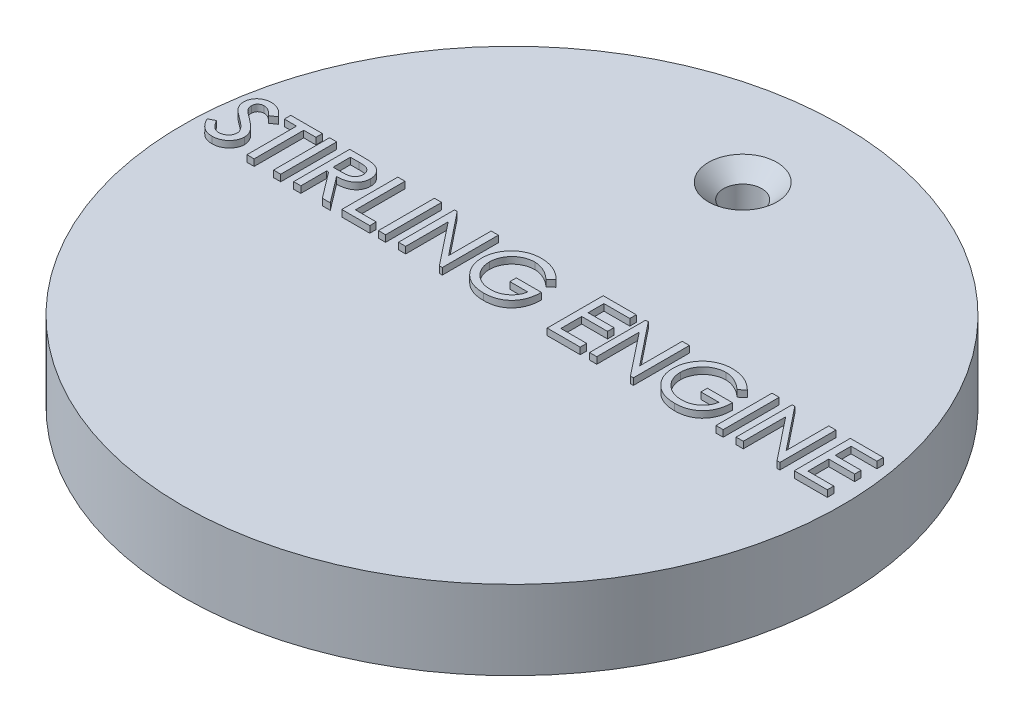
from build123d import *

# Parameters (mm, degrees)
SKETCH1_R                                       = 50
BOSS_EXTRUDE1_DEPTH                             = 12
SKETCH2_W                                       = 1.089743589
SKETCH2_H                                       = 8.5
SKETCH2_W_2                                     = 1.08974359
BOSS_EXTRUDE2_DEPTH                             = 1
CSK_FOR_M5_FLAT_HEAD_MACHINE_SCREW1_D           = 5.8
CSK_FOR_M5_FLAT_HEAD_MACHINE_SCREW1_CSINK_D     = 10.4
CSK_FOR_M5_FLAT_HEAD_MACHINE_SCREW1_CSINK_ANGLE = 90


with BuildPart() as part:
    # Sketch1 → Boss-Extrude1 (new body)
    with BuildSketch(Plane(origin=(0, 0, 0), x_dir=(1, 0, 0), z_dir=(0, 1, 0))):
        with Locations(Location((0, 0, 0), (0, 0, 270))):
            Circle(SKETCH1_R)
    extrude(amount=BOSS_EXTRUDE1_DEPTH)

    # Sketch2 → Boss-Extrude2 (add)
    # profile 1 of 14: a face of its own
    with BuildSketch(Plane(origin=(0, 12, 0), x_dir=(1, 0, 0), z_dir=(0, 1, 0))):
        with BuildLine():
            Line((-47.948717949, 1.685697115), (-47.022435897, 2.179487179))
            add(Edge.make_bspline(
                [(-47.022435897, 2.179487179), (-46.954932513, 2.06767303), (-46.825914844, 1.853965214), (-46.614061284, 1.566075414), (-46.403421464, 1.320581075), (-46.191916121, 1.117730072), (-45.976607283, 0.960780792), (-45.759693014, 0.847350269), (-45.539815692, 0.776055414), (-45.391149535, 0.767184716), (-45.318008814, 0.762820513)],
                knots=[0, 0, 0, 0, 1.354943589, 2.589672558, 3.704607527, 4.708856974, 5.624398268, 6.459549776, 7.242129862, 8, 8, 8, 8], degree=3))
            add(Edge.make_bspline(
                [(-45.318008814, 0.762820513), (-45.249728015, 0.765015342), (-45.114483395, 0.769362668), (-44.915767788, 0.80706469), (-44.723358464, 0.864509279), (-44.540589522, 0.9463091), (-44.371736126, 1.046523914), (-44.222675693, 1.165725135), (-44.096202073, 1.300678484), (-43.991958489, 1.449553226), (-43.910246149, 1.608506118), (-43.850093324, 1.773026745), (-43.814789618, 1.943589153), (-43.810075325, 2.058433808), (-43.807692308, 2.116486378)],
                knots=[0, 0, 0, 0, 1.0888553, 2.156709112, 3.216967111, 4.287545289, 5.343926646, 6.34269433, 7.323221176, 8.28571565, 9.233736345, 10.167849744, 11.073870434, 12, 12, 12, 12], degree=3))
            add(Edge.make_bspline(
                [(-43.807692308, 2.116486378), (-43.811031138, 2.182647984), (-43.817778151, 2.316345457), (-43.871931311, 2.514954649), (-43.959940078, 2.711620544), (-44.041350172, 2.834411471), (-44.083533654, 2.898036859)],
                knots=[0, 0, 0, 0, 0.941861274, 1.903286225, 2.913566088, 4, 4, 4, 4], degree=3))
            add(Edge.make_bspline(
                [(-44.083533654, 2.898036859), (-44.120009872, 2.944351522), (-44.196795407, 3.041847821), (-44.32677154, 3.188630016), (-44.478860675, 3.341745621), (-44.652816098, 3.500503879), (-44.845580199, 3.668462087), (-45.060427389, 3.841279278), (-45.295838852, 4.021876093), (-45.46080867, 4.143034561), (-45.546173878, 4.205729167)],
                knots=[0, 0, 0, 0, 0.718593868, 1.512701116, 2.388487339, 3.348232282, 4.383172848, 5.504845107, 6.708858268, 8, 8, 8, 8], degree=3))
            add(Edge.make_bspline(
                [(-45.546173878, 4.205729167), (-45.633224047, 4.269011825), (-45.800248943, 4.390433525), (-46.035572439, 4.5684383), (-46.246562855, 4.732568567), (-46.431602237, 4.882952609), (-46.590711614, 5.020897498), (-46.723555811, 5.145837186), (-46.834133988, 5.254342998), (-46.893555548, 5.327350801), (-46.920272436, 5.360176282)],
                knots=[0, 0, 0, 0, 1.435833971, 2.754963323, 3.936484598, 5.002077172, 5.935979083, 6.744956812, 7.435712417, 8, 8, 8, 8], degree=3))
            add(Edge.make_bspline(
                [(-46.920272436, 5.360176282), (-46.959275482, 5.410572014), (-47.035900104, 5.509578482), (-47.132909527, 5.66839127), (-47.216383964, 5.829282547), (-47.285137541, 5.993742065), (-47.338417421, 6.161244435), (-47.37507146, 6.332377073), (-47.400926583, 6.506460207), (-47.402869458, 6.624069949), (-47.403846154, 6.683193109)],
                knots=[0, 0, 0, 0, 1.064105702, 2.090521257, 3.104283852, 4.09061442, 5.065433238, 6.036507983, 7.012940167, 8, 8, 8, 8], degree=3))
            add(Edge.make_bspline(
                [(-47.403846154, 6.683193109), (-47.400770421, 6.775394691), (-47.394680694, 6.957947077), (-47.340260599, 7.224446215), (-47.252071898, 7.478372297), (-47.131695259, 7.718412924), (-46.977976485, 7.94009996), (-46.795134249, 8.139055339), (-46.58217925, 8.311033731), (-46.344793489, 8.45594373), (-46.088919627, 8.573466703), (-45.819424486, 8.657231695), (-45.539575093, 8.708013), (-45.349435678, 8.71461227), (-45.253305288, 8.717948718)],
                knots=[0, 0, 0, 0, 1.004530234, 1.988896367, 2.951881425, 3.928924249, 4.907494835, 5.884204368, 6.865296418, 7.88218147, 8.909671266, 9.927572845, 10.952225504, 12, 12, 12, 12], degree=3))
            add(Edge.make_bspline(
                [(-45.253305288, 8.717948718), (-45.144154717, 8.714041827), (-44.927981482, 8.70630421), (-44.609321811, 8.653867628), (-44.304604877, 8.559459163), (-44.059189016, 8.45524975), (-43.868545784, 8.348703831), (-43.724358407, 8.252474624), (-43.576573783, 8.14357056), (-43.429872688, 8.016562852), (-43.278537509, 7.877596609), (-43.130317825, 7.719117947), (-42.975833595, 7.550209476), (-42.877371, 7.428396971), (-42.826923077, 7.365985577)],
                knots=[0, 0, 0, 0, 1.360590218, 2.69465552, 4.010645498, 5.328858611, 6.009843139, 6.729980544, 7.488405022, 8.296451933, 9.147430815, 10.048128915, 10.999946711, 12, 12, 12, 12], degree=3))
            Line((-42.826923077, 7.365985577), (-43.715745192, 6.756410256))
            add(Edge.make_bspline(
                [(-43.715745192, 6.756410256), (-43.762130411, 6.805937116), (-43.851317546, 6.901164838), (-43.982509969, 7.036212299), (-44.106635889, 7.157407742), (-44.22407201, 7.264196739), (-44.332186168, 7.358483735), (-44.434016272, 7.437089352), (-44.526377965, 7.504647311), (-44.641838274, 7.571604702), (-44.783383902, 7.637918304), (-44.957593356, 7.697585336), (-45.140331571, 7.729473696), (-45.263979695, 7.734591061), (-45.326522436, 7.737179487)],
                knots=[0, 0, 0, 0, 1.253377364, 2.409930098, 3.477532466, 4.457083962, 5.341772995, 6.126101147, 6.832963523, 7.453284126, 8.588253012, 9.715448048, 10.844445545, 12, 12, 12, 12], degree=3))
            add(Edge.make_bspline(
                [(-45.326522436, 7.737179487), (-45.393280135, 7.734059761), (-45.523062552, 7.727994758), (-45.709488187, 7.676058214), (-45.880858414, 7.59410412), (-46.032055, 7.47811713), (-46.157724873, 7.334556293), (-46.249888645, 7.166392957), (-46.303825425, 6.974748481), (-46.310580172, 6.840196665), (-46.314102564, 6.770032051)],
                knots=[0, 0, 0, 0, 1.033513523, 2.009234674, 2.977584268, 3.963375862, 4.942860848, 5.915719707, 6.913112236, 8, 8, 8, 8], degree=3))
            add(Edge.make_bspline(
                [(-46.314102564, 6.770032051), (-46.31273013, 6.724567641), (-46.309988582, 6.633748788), (-46.289851138, 6.499220245), (-46.25262708, 6.369233757), (-46.205456677, 6.241049521), (-46.139434275, 6.115387777), (-46.055350805, 5.992050095), (-45.955535965, 5.867483122), (-45.878931746, 5.789174321), (-45.839042468, 5.748397436)],
                knots=[0, 0, 0, 0, 0.940834015, 1.879392378, 2.805520916, 3.734846727, 4.701501436, 5.734192883, 6.820151034, 8, 8, 8, 8], degree=3))
            add(Edge.make_bspline(
                [(-45.839042468, 5.748397436), (-45.818844828, 5.729396492), (-45.772487009, 5.68578534), (-45.687461789, 5.619003731), (-45.583871813, 5.535277434), (-45.460280955, 5.435973005), (-45.312625268, 5.326481835), (-45.146364104, 5.199489011), (-44.957287717, 5.060711605), (-44.824234135, 4.963419227), (-44.754407051, 4.912359776)],
                knots=[0, 0, 0, 0, 0.485581606, 1.114511607, 1.892484918, 2.819534315, 3.891398566, 5.11240712, 6.484579029, 8, 8, 8, 8], degree=3))
            add(Edge.make_bspline(
                [(-44.754407051, 4.912359776), (-44.659275524, 4.84301863), (-44.47524027, 4.708875768), (-44.213811875, 4.506538914), (-43.978040386, 4.308199029), (-43.761964933, 4.120775727), (-43.572892822, 3.936406973), (-43.40728148, 3.758883606), (-43.26305114, 3.589938391), (-43.109011408, 3.374537969), (-42.955002555, 3.108986255), (-42.817286809, 2.788017113), (-42.735107506, 2.464515904), (-42.723619054, 2.248597648), (-42.717948718, 2.142027244)],
                knots=[0, 0, 0, 0, 1.186540699, 2.295404303, 3.331123753, 4.291760032, 5.17774712, 5.991329992, 6.738459906, 7.414799035, 8.65800623, 9.82461674, 10.926299804, 12, 12, 12, 12], degree=3))
            add(Edge.make_bspline(
                [(-42.717948718, 2.142027244), (-42.720361425, 2.066417095), (-42.725156865, 1.916136145), (-42.759925126, 1.693936138), (-42.817776455, 1.477965355), (-42.901006072, 1.269135764), (-43.004817904, 1.065487448), (-43.133537631, 0.868800827), (-43.286745696, 0.679833812), (-43.457978503, 0.497444544), (-43.647318754, 0.329821696), (-43.850364678, 0.182291482), (-44.06649636, 0.059045563), (-44.294048312, -0.040947107), (-44.531685365, -0.122428714), (-44.781755922, -0.1782368), (-45.043023166, -0.210450051), (-45.22086437, -0.215422823), (-45.311197917, -0.217948718)],
                knots=[0, 0, 0, 0, 0.932646097, 1.853705421, 2.767602683, 3.685675702, 4.622099834, 5.5835355, 6.579838097, 7.620108014, 8.666886363, 9.695041649, 10.711275682, 11.730160242, 12.757671447, 13.80585424, 14.885494678, 16, 16, 16, 16], degree=3))
            add(Edge.make_bspline(
                [(-45.311197917, -0.217948718), (-45.377070165, -0.216485611), (-45.506811257, -0.213603896), (-45.699421976, -0.195324662), (-45.8868562, -0.160192158), (-46.070141565, -0.114769368), (-46.249392463, -0.056929578), (-46.422298847, 0.017058116), (-46.591740008, 0.102043209), (-46.75674395, 0.201551949), (-46.917521087, 0.318068848), (-47.074985091, 0.453322052), (-47.228221294, 0.609689142), (-47.379856489, 0.785138583), (-47.527887376, 0.981643816), (-47.671968359, 1.198171555), (-47.813939096, 1.434023558), (-47.902906157, 1.600152415), (-47.948717949, 1.685697115)],
                knots=[0, 0, 0, 0, 0.916943493, 1.805999526, 2.689245248, 3.568702553, 4.433092864, 5.307568578, 6.183755457, 7.069823058, 7.986358083, 8.944343836, 9.955449961, 11.030835633, 12.170024038, 13.377301724, 14.649494474, 16, 16, 16, 16], degree=3))
        make_face()
    # profile 2 of 14: a face of its own
    with BuildSketch(Plane(origin=(0, 12, 0), x_dir=(1, 0, 0), z_dir=(0, 1, 0))):
        Polygon((-42.064102564, 7.519230769), (-42.064102564, 8.5), (-37.269230769, 8.5), (-37.269230769, 7.519230769), (-39.121794872, 7.519230769), (-39.121794872, 0), (-40.211538462, 0), (-40.211538462, 7.519230769), align=None)
    # profile 3 of 14: a face of its own
    with BuildSketch(Plane(origin=(0, 12, 0), x_dir=(1, 0, 0), z_dir=(0, 1, 0))):
        with Locations((-35.634615385, 4.25)):
            Rectangle(SKETCH2_W, SKETCH2_H)
    # profile 4 of 14: a face of its own
    with BuildSketch(Plane(origin=(0, 12, 0), x_dir=(1, 0, 0), z_dir=(0, 1, 0))):
        with BuildLine():
            Line((-33.128205128, 8.5), (-31.388020833, 8.5))
            add(Edge.make_bspline(
                [(-31.388020833, 8.5), (-31.276205034, 8.499729639), (-31.062209641, 8.499212216), (-30.75514321, 8.493782567), (-30.476335061, 8.486591479), (-30.225574474, 8.471570338), (-30.002189945, 8.458311396), (-29.807147645, 8.43650415), (-29.639529301, 8.417054448), (-29.538751966, 8.395655871), (-29.492888622, 8.385917468)],
                knots=[0, 0, 0, 0, 1.411347063, 2.701065231, 3.876524531, 4.931206492, 5.871916627, 6.700262025, 7.408494688, 8, 8, 8, 8], degree=3))
            add(Edge.make_bspline(
                [(-29.492888622, 8.385917468), (-29.424502882, 8.368726156), (-29.289772558, 8.334856654), (-29.095666773, 8.268174783), (-28.912413537, 8.189561641), (-28.740254379, 8.099449604), (-28.578775361, 7.997386051), (-28.43110056, 7.880291963), (-28.291412472, 7.754148615), (-28.165100943, 7.614998398), (-28.050176556, 7.467028572), (-27.951913196, 7.310265215), (-27.867602367, 7.146813664), (-27.797235489, 6.976916893), (-27.744621013, 6.798680305), (-27.70776762, 6.613415694), (-27.682404797, 6.421673288), (-27.680465916, 6.291082045), (-27.679487179, 6.225160256)],
                knots=[0, 0, 0, 0, 1.103820101, 2.174693741, 3.209859002, 4.223626675, 5.214778413, 6.196198804, 7.171320727, 8.158999421, 9.134971582, 10.10159085, 11.051641808, 12.012235658, 12.97676874, 13.956376421, 14.968389326, 16, 16, 16, 16], degree=3))
            add(Edge.make_bspline(
                [(-27.679487179, 6.225160256), (-27.683130658, 6.116440532), (-27.690291323, 5.902769545), (-27.755367576, 5.591146401), (-27.862009256, 5.297395947), (-27.983645147, 5.067925131), (-28.101974997, 4.897327606), (-28.201043034, 4.776045853), (-28.309957581, 4.66242357), (-28.427946368, 4.555277838), (-28.558114449, 4.459343504), (-28.696490859, 4.368382741), (-28.844707937, 4.284764146), (-29.058354913, 4.184359285), (-29.347324968, 4.079709104), (-29.720696362, 3.989992334), (-30.124152428, 3.935495617), (-30.403105761, 3.927300559), (-30.546875, 3.923076923)],
                knots=[0, 0, 0, 0, 1.258986715, 2.474334223, 3.670931197, 4.871716255, 5.472099774, 6.075216246, 6.684756624, 7.295006596, 7.919971941, 8.55677058, 9.213641309, 9.890468445, 11.291088691, 12.766994829, 14.333747493, 16, 16, 16, 16], degree=3))
            Line((-30.546875, 3.923076923), (-27.570512821, 0))
            Line((-27.570512821, 0), (-28.770933494, 0))
            Line((-28.770933494, 0), (-31.747295673, 3.923076923))
            Line((-31.747295673, 3.923076923), (-32.038461538, 3.923076923))
            Line((-32.038461538, 3.923076923), (-32.038461538, 0))
            Line((-32.038461538, 0), (-33.128205128, 0))
            Line((-33.128205128, 0), (-33.128205128, 8.5))
        make_face()
        with BuildLine():
            Line((-32.038461538, 7.519230769), (-32.038461538, 4.902143429))
            Line((-32.038461538, 4.902143429), (-30.788661859, 4.893629808))
            add(Edge.make_bspline(
                [(-30.788661859, 4.893629808), (-30.721681759, 4.89380287), (-30.592223558, 4.894137364), (-30.404835056, 4.90102502), (-30.231027696, 4.912558601), (-30.071488031, 4.929640519), (-29.926678807, 4.950019823), (-29.795490014, 4.972844814), (-29.679153489, 5.003665839), (-29.543257818, 5.048093228), (-29.392276017, 5.119470028), (-29.232112307, 5.228144173), (-29.091723162, 5.356757357), (-28.976596792, 5.507458549), (-28.884483386, 5.672794351), (-28.81747299, 5.849323229), (-28.77710643, 6.036050149), (-28.771885871, 6.163663423), (-28.769230769, 6.228565705)],
                knots=[0, 0, 0, 0, 1.165824803, 2.253289887, 3.263370799, 4.197285623, 5.045371766, 5.808848116, 6.513348392, 7.138183875, 8.296069948, 9.40583476, 10.496436725, 11.595152671, 12.691956992, 13.780050175, 14.870965332, 16, 16, 16, 16], degree=3))
            add(Edge.make_bspline(
                [(-28.769230769, 6.228565705), (-28.772011479, 6.291173178), (-28.777526912, 6.415352745), (-28.816755041, 6.597602095), (-28.886874129, 6.769536653), (-28.9799062, 6.930935406), (-29.095177433, 7.076031346), (-29.227741985, 7.203885902), (-29.380881536, 7.305228432), (-29.521869673, 7.373627828), (-29.648225995, 7.416525363), (-29.760109229, 7.443017075), (-29.887457915, 7.466408577), (-30.030532255, 7.486967735), (-30.189067827, 7.501988471), (-30.36346009, 7.511438468), (-30.553622984, 7.518863472), (-30.68592243, 7.519105248), (-30.754607372, 7.519230769)],
                knots=[0, 0, 0, 0, 1.114111647, 2.20979856, 3.297775031, 4.406653707, 5.514151176, 6.585969385, 7.670234779, 8.768154562, 9.365517569, 10.041721951, 10.812428959, 11.669578816, 12.61341719, 13.645562296, 14.777663698, 16, 16, 16, 16], degree=3))
            Line((-30.754607372, 7.519230769), (-32.038461538, 7.519230769))
        make_face(mode=Mode.SUBTRACT)
    # profile 5 of 14: a face of its own
    with BuildSketch(Plane(origin=(0, 12, 0), x_dir=(1, 0, 0), z_dir=(0, 1, 0))):
        Polygon((-25.826923077, 8.5), (-24.737179487, 8.5), (-24.737179487, 0.980769231), (-21.576923077, 0.980769231), (-21.576923077, 0), (-25.826923077, 0), align=None)
    # profile 6 of 14: a face of its own
    with BuildSketch(Plane(origin=(0, 12, 0), x_dir=(1, 0, 0), z_dir=(0, 1, 0))):
        with Locations((-19.724358974, 4.25)):
            Rectangle(SKETCH2_W_2, SKETCH2_H)
    # profile 7 of 14: a face of its own
    with BuildSketch(Plane(origin=(0, 12, 0), x_dir=(1, 0, 0), z_dir=(0, 1, 0))):
        Polygon((-17.217948718, 0), (-17.217948718, 8.5), (-16.814403045, 8.5), (-11.66025641, 2.041566506), (-11.66025641, 8.5), (-10.570512821, 8.5), (-10.570512821, 0), (-11.016626603, 0), (-16.128205128, 6.44140625), (-16.128205128, 0), align=None)
    # profile 8 of 14: a face of its own
    with BuildSketch(Plane(origin=(0, 12, 0), x_dir=(1, 0, 0), z_dir=(0, 1, 0))):
        with BuildLine():
            Line((-0.326923077, 7.0390625), (-1.152744391, 6.320512821))
            add(Edge.make_bspline(
                [(-1.152744391, 6.320512821), (-1.282304451, 6.433644896), (-1.534524014, 6.653883469), (-1.929446562, 6.94480759), (-2.32657891, 7.19019412), (-2.726026212, 7.387113639), (-3.121045934, 7.544833274), (-3.513438094, 7.653264975), (-3.900082674, 7.724105045), (-4.15719249, 7.732859769), (-4.284054487, 7.737179487)],
                knots=[0, 0, 0, 0, 1.174203348, 2.285866929, 3.345479548, 4.357773815, 5.323690501, 6.245291137, 7.134199255, 8, 8, 8, 8], degree=3))
            add(Edge.make_bspline(
                [(-4.284054487, 7.737179487), (-4.357332831, 7.736031602), (-4.503660399, 7.733739422), (-4.721976988, 7.710169092), (-4.938164954, 7.675009572), (-5.15235591, 7.624690311), (-5.36500299, 7.562647183), (-5.574478468, 7.483528119), (-5.782071291, 7.390979749), (-5.986098961, 7.284474), (-6.184405599, 7.166324326), (-6.372881938, 7.036294491), (-6.550352928, 6.894595631), (-6.717151144, 6.741628657), (-6.872297005, 6.577160089), (-7.018089687, 6.403555997), (-7.150753192, 6.216746756), (-7.272869951, 6.020755295), (-7.380559959, 5.816973547), (-7.477488672, 5.610305274), (-7.557283428, 5.398997794), (-7.621860942, 5.18375461), (-7.673295209, 4.964857232), (-7.710632545, 4.7425468), (-7.733737738, 4.516117735), (-7.736025342, 4.364137293), (-7.737179487, 4.287459936)],
                knots=[0, 0, 0, 0, 0.9732313, 1.943419598, 2.914105962, 3.881741322, 4.864768402, 5.855028487, 6.854206409, 7.882911434, 8.911035887, 9.919250175, 10.922630637, 11.925982763, 12.923451909, 13.924676513, 14.935397504, 15.964931351, 16.990480746, 17.995899336, 18.995873688, 19.988284801, 20.979664002, 21.981342857, 22.981544644, 24, 24, 24, 24], degree=3))
            add(Edge.make_bspline(
                [(-7.737179487, 4.287459936), (-7.735227479, 4.209094488), (-7.731330178, 4.052633233), (-7.709692988, 3.819732372), (-7.670080352, 3.591113379), (-7.61505589, 3.366518566), (-7.54553741, 3.145671956), (-7.460277402, 2.928004786), (-7.356988991, 2.715698291), (-7.242444063, 2.50680181), (-7.113545235, 2.306314648), (-6.9712111, 2.117338869), (-6.820246997, 1.93743349), (-6.656121401, 1.771606851), (-6.483781442, 1.614310505), (-6.297218777, 1.472459668), (-6.101675531, 1.33908197), (-5.89584922, 1.218255476), (-5.681561531, 1.11169648), (-5.462364801, 1.017676922), (-5.237542919, 0.939072806), (-5.008484348, 0.874283293), (-4.773987512, 0.825016345), (-4.535753957, 0.789661999), (-4.292472452, 0.766122998), (-4.128594512, 0.763930106), (-4.045673077, 0.762820513)],
                knots=[0, 0, 0, 0, 0.993588149, 1.983757546, 2.962012758, 3.932297264, 4.913089422, 5.895147596, 6.892791648, 7.904042674, 8.913936126, 9.911190904, 10.901569418, 11.888649192, 12.866825019, 13.856968273, 14.856789458, 15.866221433, 16.879824684, 17.888846278, 18.887838639, 19.896937192, 20.90452114, 21.923117541, 22.949107649, 24, 24, 24, 24], degree=3))
            add(Edge.make_bspline(
                [(-4.045673077, 0.762820513), (-3.94227144, 0.765147493), (-3.73830782, 0.769737549), (-3.438920137, 0.804885228), (-3.151024205, 0.859154061), (-2.877553434, 0.943500287), (-2.614147221, 1.043822887), (-2.364735003, 1.171623324), (-2.126330362, 1.319803022), (-1.904056191, 1.491726314), (-1.696909417, 1.676898725), (-1.51243757, 1.876247927), (-1.347464798, 2.083306094), (-1.208374353, 2.303045846), (-1.087640834, 2.52930835), (-0.99200385, 2.766863967), (-0.917870444, 3.013694014), (-0.887211481, 3.183729706), (-0.871794872, 3.269230769)],
                knots=[0, 0, 0, 0, 1.125101743, 2.219305524, 3.276925285, 4.308813505, 5.329771737, 6.340890082, 7.353855978, 8.380572537, 9.395307413, 10.374367262, 11.333343716, 12.272376171, 13.200803521, 14.12078735, 15.055053215, 16, 16, 16, 16], degree=3))
            Line((-0.871794872, 3.269230769), (-3.596153846, 3.269230769))
            Line((-3.596153846, 3.269230769), (-3.596153846, 4.25))
            Line((-3.596153846, 4.25), (0.217948718, 4.25))
            add(Edge.make_bspline(
                [(0.217948718, 4.25), (0.214086088, 4.081802362), (0.2065458, 3.753461688), (0.146011486, 3.274850472), (0.056756583, 2.822254966), (-0.073643336, 2.397584395), (-0.238868446, 2.000240248), (-0.440665249, 1.630213092), (-0.678637294, 1.287610743), (-0.951179342, 0.974365113), (-1.254180196, 0.69338788), (-1.584426357, 0.447325135), (-1.943398384, 0.243100387), (-2.326511443, 0.073438551), (-2.73588664, -0.057651617), (-3.17046992, -0.150501712), (-3.630940159, -0.207941251), (-3.946742757, -0.214556618), (-4.108673878, -0.217948718)],
                knots=[0, 0, 0, 0, 1.147910205, 2.240849596, 3.288798376, 4.293882934, 5.268269983, 6.221997348, 7.165762291, 8.110600512, 9.051082397, 9.981847279, 10.915696266, 11.864665164, 12.837641225, 13.844673414, 14.894833504, 16, 16, 16, 16], degree=3))
            add(Edge.make_bspline(
                [(-4.108673878, -0.217948718), (-4.204059025, -0.216554651), (-4.392741019, -0.213797037), (-4.671682545, -0.194474839), (-4.943477553, -0.164616251), (-5.207002462, -0.119793233), (-5.463680556, -0.064338701), (-5.711421643, 0.006582913), (-5.953596786, 0.085170135), (-6.185921192, 0.182319414), (-6.413343515, 0.286566492), (-6.632092237, 0.406540943), (-6.842368058, 0.540173259), (-7.048621842, 0.682174804), (-7.242926929, 0.841517658), (-7.431800329, 1.010587524), (-7.61233189, 1.192813764), (-7.725918929, 1.322416343), (-7.783153045, 1.387720353)],
                knots=[0, 0, 0, 0, 1.103516608, 2.18287355, 3.233646581, 4.265703846, 5.274262808, 6.270085734, 7.246073526, 8.217965859, 9.181570311, 10.139587173, 11.101556858, 12.063436887, 13.034641265, 14.006444858, 14.995489556, 16, 16, 16, 16], degree=3))
            add(Edge.make_bspline(
                [(-7.783153045, 1.387720353), (-7.867033363, 1.491153753), (-8.032992067, 1.695798581), (-8.242108562, 2.027284371), (-8.425697203, 2.366593361), (-8.571647188, 2.72085318), (-8.686311651, 3.086608006), (-8.768547292, 3.464862153), (-8.816387606, 3.855437518), (-8.823388678, 4.119896691), (-8.826923077, 4.253405449)],
                knots=[0, 0, 0, 0, 1.024988564, 2.027958144, 3.013741914, 3.99376912, 4.974186348, 5.962951834, 6.97162285, 8, 8, 8, 8], degree=3))
            add(Edge.make_bspline(
                [(-8.826923077, 4.253405449), (-8.825649908, 4.353381732), (-8.823126948, 4.551498581), (-8.79183216, 4.845892062), (-8.746956311, 5.135556231), (-8.682119011, 5.42003356), (-8.598360683, 5.698744032), (-8.495400862, 5.972087874), (-8.375209306, 6.241019742), (-8.234769231, 6.50226021), (-8.081920563, 6.755752592), (-7.910141093, 6.993621894), (-7.728235303, 7.220345857), (-7.529834938, 7.43048156), (-7.320632828, 7.62987591), (-7.094564833, 7.811517456), (-6.856316407, 7.980802789), (-6.603840843, 8.133669996), (-6.341257252, 8.271041483), (-6.069122454, 8.391521777), (-5.787968001, 8.490669106), (-5.499752508, 8.575774374), (-5.202241882, 8.637669051), (-4.896988701, 8.683373086), (-4.583224697, 8.714108262), (-4.370966571, 8.716658827), (-4.263621795, 8.717948718)],
                knots=[0, 0, 0, 0, 1.010042427, 2.001538926, 2.988977894, 3.97147212, 4.947868168, 5.928132478, 6.921817128, 7.922678872, 8.924230854, 9.911186466, 10.885946514, 11.860014231, 12.829900618, 13.804660667, 14.788293046, 15.781961137, 16.785220236, 17.781814947, 18.787040195, 19.796447094, 20.816926666, 21.855387176, 22.915410262, 24, 24, 24, 24], degree=3))
            add(Edge.make_bspline(
                [(-4.263621795, 8.717948718), (-4.173356045, 8.716347297), (-3.993807596, 8.713161895), (-3.726642377, 8.696585023), (-3.463428024, 8.666076906), (-3.204744802, 8.620588677), (-2.949047488, 8.567536626), (-2.698694871, 8.4986722), (-2.452712527, 8.418412485), (-2.209892426, 8.326216883), (-1.96923097, 8.220502445), (-1.730052959, 8.099600364), (-1.493379601, 7.960496587), (-1.256715063, 7.807571003), (-1.021541306, 7.638688451), (-0.788232644, 7.453746326), (-0.553960662, 7.25531032), (-0.403413014, 7.111917319), (-0.326923077, 7.0390625)],
                knots=[0, 0, 0, 0, 0.985310127, 1.959889608, 2.920407961, 3.875718043, 4.825872088, 5.769643135, 6.708031182, 7.649175746, 8.603380435, 9.575831151, 10.572468945, 11.59831001, 12.650450436, 13.731164539, 14.847254788, 16, 16, 16, 16], degree=3))
        make_face()
    # profile 9 of 14: a face of its own
    with BuildSketch(Plane(origin=(0, 12, 0), x_dir=(1, 0, 0), z_dir=(0, 1, 0))):
        Polygon((5.33974359, 8.5), (10.352564103, 8.5), (10.352564103, 7.519230769), (6.429487179, 7.519230769), (6.429487179, 5.121794872), (10.352564103, 5.121794872), (10.352564103, 4.141025641), (6.429487179, 4.141025641), (6.429487179, 0.980769231), (10.352564103, 0.980769231), (10.352564103, 0), (5.33974359, 0), align=None)
    # profile 10 of 14: a face of its own
    with BuildSketch(Plane(origin=(0, 12, 0), x_dir=(1, 0, 0), z_dir=(0, 1, 0))):
        Polygon((11.769230769, 0), (11.769230769, 8.5), (12.172776442, 8.5), (17.326923077, 2.041566506), (17.326923077, 8.5), (18.416666667, 8.5), (18.416666667, 0), (17.970552885, 0), (12.858974359, 6.44140625), (12.858974359, 0), align=None)
    # profile 11 of 14: a face of its own
    with BuildSketch(Plane(origin=(0, 12, 0), x_dir=(1, 0, 0), z_dir=(0, 1, 0))):
        with BuildLine():
            Line((28.66025641, 7.0390625), (27.834435096, 6.320512821))
            add(Edge.make_bspline(
                [(27.834435096, 6.320512821), (27.704875036, 6.433644896), (27.452655473, 6.653883469), (27.057732925, 6.94480759), (26.660600577, 7.19019412), (26.261153275, 7.387113639), (25.866133553, 7.544833274), (25.473741393, 7.653264975), (25.087096813, 7.724105045), (24.829986997, 7.732859769), (24.703125, 7.737179487)],
                knots=[0, 0, 0, 0, 1.174203348, 2.285866929, 3.345479548, 4.357773815, 5.323690501, 6.245291137, 7.134199255, 8, 8, 8, 8], degree=3))
            add(Edge.make_bspline(
                [(24.703125, 7.737179487), (24.629846656, 7.736031602), (24.483519088, 7.733739422), (24.2652025, 7.710169092), (24.049014533, 7.675009572), (23.834823577, 7.624690311), (23.622176497, 7.562647183), (23.412701019, 7.483528119), (23.205108196, 7.390979749), (23.001080526, 7.284474), (22.802773888, 7.166324326), (22.614297549, 7.036294491), (22.436826559, 6.894595631), (22.270028343, 6.741628657), (22.114882482, 6.577160089), (21.9690898, 6.403555997), (21.836426295, 6.216746756), (21.714309536, 6.020755295), (21.606619528, 5.816973547), (21.509690815, 5.610305274), (21.429896059, 5.398997794), (21.365318545, 5.18375461), (21.313884279, 4.964857232), (21.276546942, 4.7425468), (21.253441749, 4.516117735), (21.251154145, 4.364137293), (21.25, 4.287459936)],
                knots=[0, 0, 0, 0, 0.9732313, 1.943419598, 2.914105962, 3.881741322, 4.864768402, 5.855028487, 6.854206409, 7.882911434, 8.911035887, 9.919250175, 10.922630637, 11.925982763, 12.923451909, 13.924676513, 14.935397504, 15.964931351, 16.990480746, 17.995899336, 18.995873688, 19.988284801, 20.979664002, 21.981342857, 22.981544644, 24, 24, 24, 24], degree=3))
            add(Edge.make_bspline(
                [(21.25, 4.287459936), (21.251952009, 4.209094488), (21.255849309, 4.052633233), (21.277486499, 3.819732372), (21.317099135, 3.591113379), (21.372123597, 3.366518566), (21.441642077, 3.145671956), (21.526902085, 2.928004786), (21.630190496, 2.715698291), (21.744735424, 2.50680181), (21.873634252, 2.306314648), (22.015968387, 2.117338869), (22.16693249, 1.93743349), (22.331058086, 1.771606851), (22.503398045, 1.614310505), (22.689960711, 1.472459668), (22.885503957, 1.33908197), (23.091330267, 1.218255476), (23.305617956, 1.11169648), (23.524814686, 1.017676922), (23.749636568, 0.939072806), (23.978695139, 0.874283293), (24.213191975, 0.825016345), (24.45142553, 0.789661999), (24.694707036, 0.766122998), (24.858584975, 0.763930106), (24.94150641, 0.762820513)],
                knots=[0, 0, 0, 0, 0.993588149, 1.983757546, 2.962012758, 3.932297264, 4.913089422, 5.895147596, 6.892791648, 7.904042674, 8.913936126, 9.911190904, 10.901569418, 11.888649192, 12.866825019, 13.856968273, 14.856789458, 15.866221433, 16.879824684, 17.888846278, 18.887838639, 19.896937192, 20.90452114, 21.923117541, 22.949107649, 24, 24, 24, 24], degree=3))
            add(Edge.make_bspline(
                [(24.94150641, 0.762820513), (25.044908047, 0.765147493), (25.248871667, 0.769737549), (25.54825935, 0.804885228), (25.836155282, 0.859154061), (26.109626053, 0.943500287), (26.373032266, 1.043822887), (26.622444485, 1.171623324), (26.860849125, 1.319803022), (27.083123297, 1.491726314), (27.29027007, 1.676898725), (27.474741917, 1.876247927), (27.639714689, 2.083306094), (27.778805134, 2.303045846), (27.899538653, 2.52930835), (27.995175637, 2.766863967), (28.069309043, 3.013694014), (28.099968006, 3.183729706), (28.115384615, 3.269230769)],
                knots=[0, 0, 0, 0, 1.125101743, 2.219305524, 3.276925285, 4.308813505, 5.329771737, 6.340890082, 7.353855978, 8.380572537, 9.395307413, 10.374367262, 11.333343716, 12.272376171, 13.200803521, 14.12078735, 15.055053215, 16, 16, 16, 16], degree=3))
            Line((28.115384615, 3.269230769), (25.391025641, 3.269230769))
            Line((25.391025641, 3.269230769), (25.391025641, 4.25))
            Line((25.391025641, 4.25), (29.205128205, 4.25))
            add(Edge.make_bspline(
                [(29.205128205, 4.25), (29.201265575, 4.081802362), (29.193725287, 3.753461688), (29.133190973, 3.274850472), (29.04393607, 2.822254966), (28.913536151, 2.397584395), (28.748311041, 2.000240248), (28.546514238, 1.630213092), (28.308542194, 1.287610743), (28.036000146, 0.974365113), (27.732999291, 0.69338788), (27.40275313, 0.447325135), (27.043781103, 0.243100387), (26.660668044, 0.073438551), (26.251292847, -0.057651617), (25.816709568, -0.150501712), (25.356239328, -0.207941251), (25.04043673, -0.214556618), (24.878505609, -0.217948718)],
                knots=[0, 0, 0, 0, 1.147910205, 2.240849596, 3.288798376, 4.293882934, 5.268269983, 6.221997348, 7.165762291, 8.110600512, 9.051082397, 9.981847279, 10.915696266, 11.864665164, 12.837641225, 13.844673414, 14.894833504, 16, 16, 16, 16], degree=3))
            add(Edge.make_bspline(
                [(24.878505609, -0.217948718), (24.783120462, -0.216554651), (24.594438468, -0.213797037), (24.315496942, -0.194474839), (24.043701935, -0.164616251), (23.780177025, -0.119793233), (23.523498931, -0.064338701), (23.275757844, 0.006582913), (23.033582701, 0.085170135), (22.801258295, 0.182319414), (22.573835973, 0.286566492), (22.35508725, 0.406540943), (22.144811429, 0.540173259), (21.938557645, 0.682174804), (21.744252558, 0.841517658), (21.555379159, 1.010587524), (21.374847597, 1.192813764), (21.261260558, 1.322416343), (21.204026442, 1.387720353)],
                knots=[0, 0, 0, 0, 1.103516608, 2.18287355, 3.233646581, 4.265703846, 5.274262808, 6.270085734, 7.246073526, 8.217965859, 9.181570311, 10.139587173, 11.101556858, 12.063436887, 13.034641265, 14.006444858, 14.995489556, 16, 16, 16, 16], degree=3))
            add(Edge.make_bspline(
                [(21.204026442, 1.387720353), (21.120146124, 1.491153753), (20.95418742, 1.695798581), (20.745070925, 2.027284371), (20.561482284, 2.366593361), (20.415532299, 2.72085318), (20.300867836, 3.086608006), (20.218632195, 3.464862153), (20.170791881, 3.855437518), (20.16379081, 4.119896691), (20.16025641, 4.253405449)],
                knots=[0, 0, 0, 0, 1.024988564, 2.027958144, 3.013741914, 3.99376912, 4.974186348, 5.962951834, 6.97162285, 8, 8, 8, 8], degree=3))
            add(Edge.make_bspline(
                [(20.16025641, 4.253405449), (20.161529579, 4.353381732), (20.16405254, 4.551498581), (20.195347327, 4.845892062), (20.240223176, 5.135556231), (20.305060476, 5.42003356), (20.388818805, 5.698744032), (20.491778625, 5.972087874), (20.611970181, 6.241019742), (20.752410256, 6.50226021), (20.905258924, 6.755752592), (21.077038395, 6.993621894), (21.258944184, 7.220345857), (21.457344549, 7.43048156), (21.666546659, 7.62987591), (21.892614654, 7.811517456), (22.13086308, 7.980802789), (22.383338644, 8.133669996), (22.645922236, 8.271041483), (22.918057033, 8.391521777), (23.199211486, 8.490669106), (23.487426979, 8.575774374), (23.784937605, 8.637669051), (24.090190787, 8.683373086), (24.40395479, 8.714108262), (24.616212916, 8.716658827), (24.723557692, 8.717948718)],
                knots=[0, 0, 0, 0, 1.010042427, 2.001538926, 2.988977894, 3.97147212, 4.947868168, 5.928132478, 6.921817128, 7.922678872, 8.924230854, 9.911186466, 10.885946514, 11.860014231, 12.829900618, 13.804660667, 14.788293046, 15.781961137, 16.785220236, 17.781814947, 18.787040195, 19.796447094, 20.816926666, 21.855387176, 22.915410262, 24, 24, 24, 24], degree=3))
            add(Edge.make_bspline(
                [(24.723557692, 8.717948718), (24.813823442, 8.716347297), (24.993371891, 8.713161895), (25.26053711, 8.696585023), (25.523751463, 8.666076906), (25.782434685, 8.620588677), (26.038132, 8.567536626), (26.288484616, 8.4986722), (26.53446696, 8.418412485), (26.777287061, 8.326216883), (27.017948517, 8.220502445), (27.257126529, 8.099600364), (27.493799886, 7.960496587), (27.730464424, 7.807571003), (27.965638181, 7.638688451), (28.198946843, 7.453746326), (28.433218825, 7.25531032), (28.583766473, 7.111917319), (28.66025641, 7.0390625)],
                knots=[0, 0, 0, 0, 0.985310127, 1.959889608, 2.920407961, 3.875718043, 4.825872088, 5.769643135, 6.708031182, 7.649175746, 8.603380435, 9.575831151, 10.572468945, 11.59831001, 12.650450436, 13.731164539, 14.847254788, 16, 16, 16, 16], degree=3))
        make_face()
    # profile 12 of 14: a face of its own
    with BuildSketch(Plane(origin=(0, 12, 0), x_dir=(1, 0, 0), z_dir=(0, 1, 0))):
        with Locations((31.493589744, 4.25)):
            Rectangle(SKETCH2_W, SKETCH2_H)
    # profile 13 of 14: a face of its own
    with BuildSketch(Plane(origin=(0, 12, 0), x_dir=(1, 0, 0), z_dir=(0, 1, 0))):
        Polygon((34, 0), (34, 8.5), (34.403545673, 8.5), (39.557692308, 2.041566506), (39.557692308, 8.5), (40.647435897, 8.5), (40.647435897, 0), (40.201322115, 0), (35.08974359, 6.44140625), (35.08974359, 0), align=None)
    # profile 14 of 14: a face of its own
    with BuildSketch(Plane(origin=(0, 12, 0), x_dir=(1, 0, 0), z_dir=(0, 1, 0))):
        Polygon((42.826923077, 8.5), (47.83974359, 8.5), (47.83974359, 7.519230769), (43.916666667, 7.519230769), (43.916666667, 5.121794872), (47.83974359, 5.121794872), (47.83974359, 4.141025641), (43.916666667, 4.141025641), (43.916666667, 0.980769231), (47.83974359, 0.980769231), (47.83974359, 0), (42.826923077, 0), align=None)
    extrude(amount=BOSS_EXTRUDE2_DEPTH)

    # CSK for M5 Flat Head Machine Screw1 (through all)
    with Locations(Plane(origin=(0, 12, 0), x_dir=(1, 0, 0), z_dir=(0, 1, 0))):
        with Locations((0, 35)):
            CounterSinkHole(CSK_FOR_M5_FLAT_HEAD_MACHINE_SCREW1_D / 2, CSK_FOR_M5_FLAT_HEAD_MACHINE_SCREW1_CSINK_D / 2, counter_sink_angle=CSK_FOR_M5_FLAT_HEAD_MACHINE_SCREW1_CSINK_ANGLE)


solid = part.part
